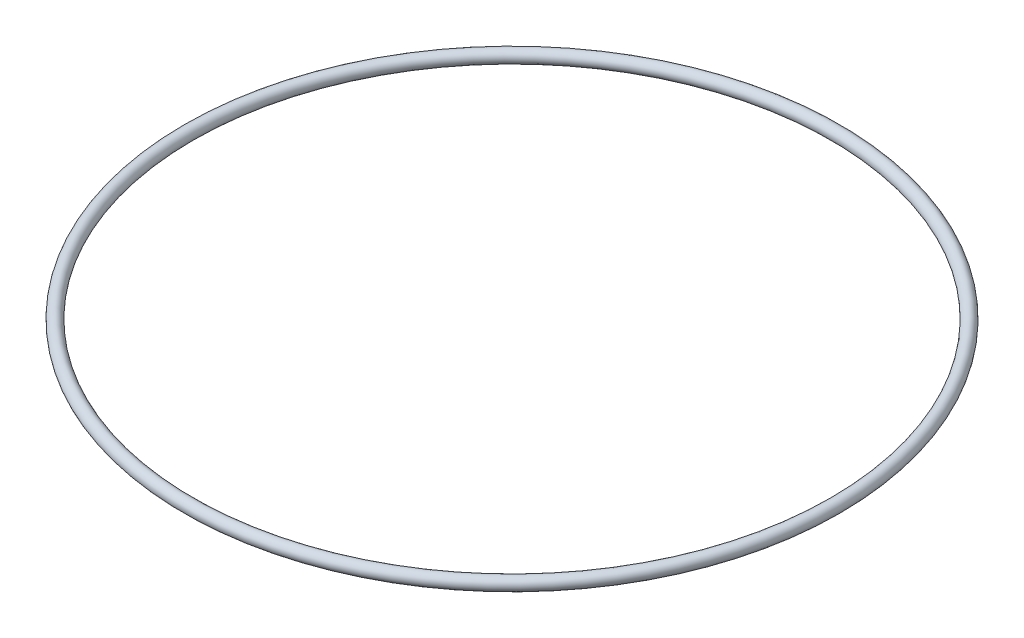
from build123d import *

# Parameters (mm, degrees)
SKETCH2_R = 0.4


with BuildPart() as part:
    # Sketch2 → Revolve1 (revolve)
    with BuildSketch(Plane.XY, mode=Mode.PRIVATE) as revolve1_sk:
        with Locations((-20.4, 0)):
            Circle(SKETCH2_R)
    revolve(revolve1_sk.sketch.rotate(Axis((0, -1.706603442, 0), (0, 1, 0)), 180), axis=Axis((0, -1.706603442, 0), (0, 1, 0)))


solid = part.part
